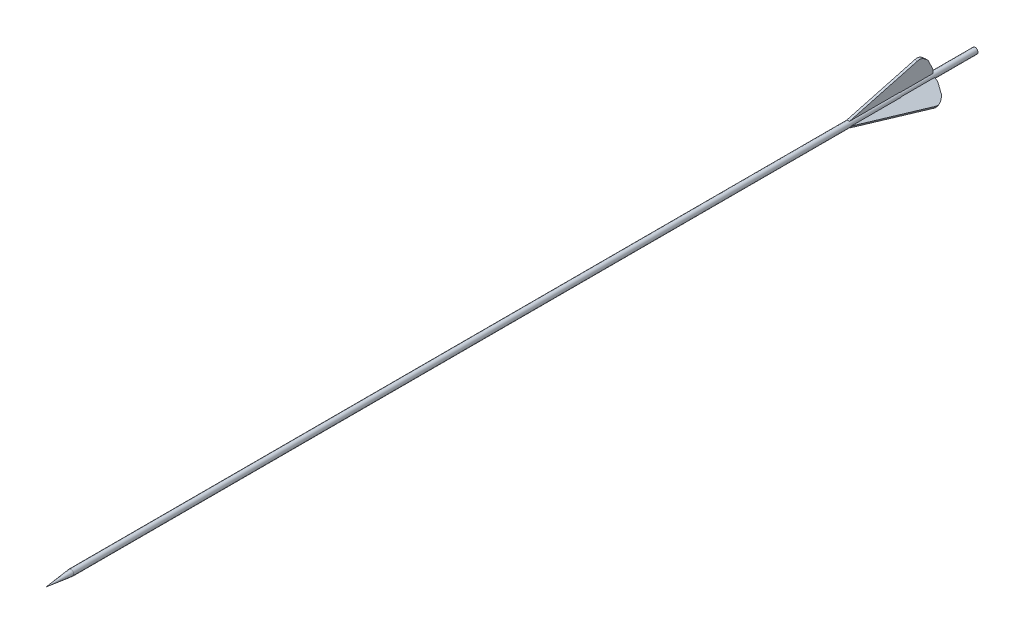
from build123d import *

# Parameters (mm, degrees)
BOSS_EXTRUDE1_DEPTH = 1
CIRPATTERN5_COUNT   = 3


with BuildPart() as part:
    # Sketch1 → Revolve1 (revolve)
    with BuildSketch(Plane(origin=(0, 0, 0), x_dir=(0, 0, -1), z_dir=(1, 0, 0))):
        Polygon((-346.125224176, 2.2352), (365.85189849, 2.2352), (365.747378609, 0), (-365.747378609, 0), align=None)
    revolve(axis=Axis((0, 0, 365.747378609), (0, 0, -1)))


with BuildPart() as body_2:
    # Sketch3 → Boss-Extrude1 (new, symmetric)
    with BuildSketch(Plane(origin=(0, 0, 0), x_dir=(0, 0, -1), z_dir=(1, 0, 0))):
        with BuildLine():
            Line((304.595078034, 2.2352), (265.85189849, 2.2352))
            Line((265.85189849, 2.2352), (319.438641364, 16.593724478))
            ThreePointArc((319.438641364, 16.593724478), (322.239457722, 16.666963296), (324.768164309, 15.460489428))
            add(Edge.make_bspline(
                [(304.595078034, 2.2352), (317.618960328, 0.07477359), (336.834434555, -3.698336964), (326.789941802, 13.868265136), (329.183734977, 11.883754495), (324.768164309, 15.460489428)],
                knots=[0, 0, 0, 0, 0.505374178, 0.593785368, 0.884111896, 0.884111896, 0.884111896, 0.884111896], degree=3))
        make_face()
    extrude(amount=BOSS_EXTRUDE1_DEPTH, both=True)


with BuildPart() as cirpattern5_1:
    # CirPattern5: pattern copy
    add(body_2.part.rotate(Axis((0, 0, -365.747378609), (0, 0, -1)), 1 * 360 / CIRPATTERN5_COUNT))


with BuildPart() as cirpattern5_2:
    # CirPattern5: pattern copy
    add(body_2.part.rotate(Axis((0, 0, -365.747378609), (0, 0, -1)), 2 * 360 / CIRPATTERN5_COUNT))


solid = Compound([part.part, body_2.part, cirpattern5_1.part, cirpattern5_2.part])
